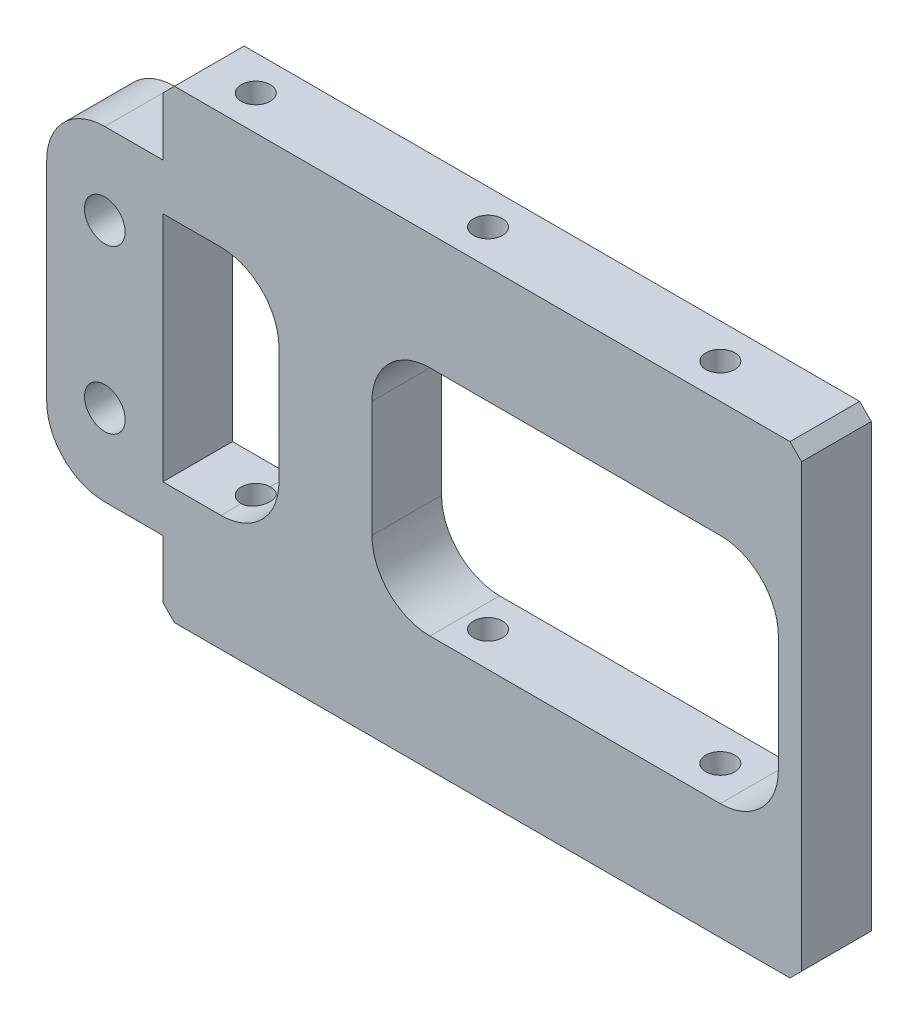
from build123d import *

# Parameters (mm, degrees)
SKETCH3_W             = 55
SKETCH3_H             = 6
BOSS_EXTRUDE1_DEPTH   = 40
M3X0_5_TAPPED_HOLE1_D = 2.5
CUT_EXTRUDE1_DEPTH    = 10
CHAMFER1_SIZE         = 1
SKETCH7_R             = 1.75
BOSS_EXTRUDE2_DEPTH   = 6


with BuildPart() as part:
    # Sketch3 → Boss-Extrude1 (new body)
    with BuildSketch(Plane(origin=(0, 0, 0), x_dir=(1, 0, 0), z_dir=(0, 1, 0))):
        Rectangle(SKETCH3_W, SKETCH3_H)
    extrude(amount=BOSS_EXTRUDE1_DEPTH)

    # M3x0.5 Tapped Hole1 (through all)
    with Locations(Plane(origin=(0, 40, 0), x_dir=(1, 0, 0), z_dir=(0, 1, 0))):
        with Locations((-22.5, 0), (-2.5, 0), (17.5, 0)):
            Hole(M3X0_5_TAPPED_HOLE1_D / 2)

    # Sketch6 → Cut-Extrude1 (cut)
    with BuildSketch(Plane.XY.offset(3)):
        with BuildLine():
            Line((-27.5, 30), (-22.5, 30))
            ThreePointArc((-22.5, 30), (-18.964466094, 28.535533906), (-17.5, 25))
            Line((-17.5, 25), (-17.5, 15))
            ThreePointArc((-17.5, 15), (-18.964466094, 11.464466094), (-22.5, 10))
            Line((-22.5, 10), (-27.5, 10))
            Line((-27.5, 10), (-27.5, 30))
        make_face()
        with BuildLine():
            Line((-4.5, 30), (20.5, 30))
            ThreePointArc((20.5, 30), (24.035533906, 28.535533906), (25.5, 25))
            Line((25.5, 25), (25.5, 15))
            ThreePointArc((25.5, 15), (24.035533906, 11.464466094), (20.5, 10))
            Line((20.5, 10), (-4.5, 10))
            ThreePointArc((-4.5, 10), (-8.035533906, 11.464466094), (-9.5, 15))
            Line((-9.5, 15), (-9.5, 25))
            ThreePointArc((-9.5, 25), (-8.035533906, 28.535533906), (-4.5, 30))
        make_face()
    extrude(amount=-CUT_EXTRUDE1_DEPTH, mode=Mode.SUBTRACT)

    # Chamfer1
    chamfer1_edges = [part.edges().sort_by_distance(p)[0] for p in [
        (-27.5, 40, 0),
        (27.5, 40, 0),
        (-27.5, 0, 0),
        (27.5, 0, 0),
    ]]
    chamfer(chamfer1_edges, length=CHAMFER1_SIZE)

    # Sketch7 → Boss-Extrude2 (add)
    with BuildSketch(Plane.XY.offset(3)):
        with BuildLine():
            Line((-27.5, 34), (-32.5, 34))
            ThreePointArc((-32.5, 34), (-36.035533906, 32.535533906), (-37.5, 29))
            Line((-37.5, 29), (-37.5, 11))
            ThreePointArc((-37.5, 11), (-36.035533906, 7.464466094), (-32.5, 6))
            Line((-32.5, 6), (-27.5, 6))
            Line((-27.5, 6), (-27.5, 34))
        make_face()
        with Locations((-32.5, 27)):
            Circle(SKETCH7_R, mode=Mode.SUBTRACT)
        with Locations((-32.5, 13)):
            Circle(SKETCH7_R, mode=Mode.SUBTRACT)
    extrude(amount=-BOSS_EXTRUDE2_DEPTH)


solid = part.part
